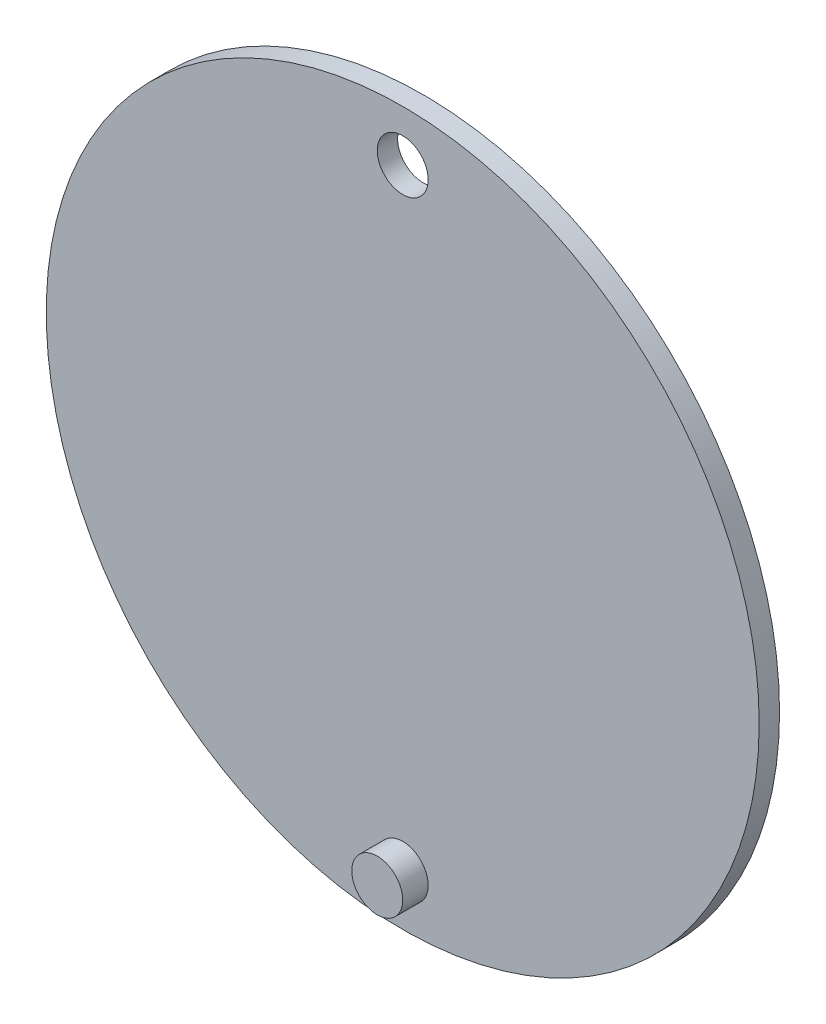
from build123d import *

# Parameters (mm, degrees)
SKETCH1_R           = 88.9
SKETCH1_R_2         = 6
SKETCH1_R_3         = 6.35
BOSS_EXTRUDE1_DEPTH = 5.08
SKETCH2_R           = 6.35
BOSS_EXTRUDE2_DEPTH = 11.43
SKETCH3_R           = 6.35
BOSS_EXTRUDE3_DEPTH = 50.8
CUT_EXTRUDE1_DEPTH  = 18


with BuildPart() as part:
    # Sketch1 → Boss-Extrude1 (new body)
    with BuildSketch(Plane.XY):
        Circle(SKETCH1_R)
        Circle(SKETCH1_R_2, mode=Mode.SUBTRACT)
        with Locations((0, -76.2)):
            Circle(SKETCH1_R_3, mode=Mode.SUBTRACT)
        with Locations((0, 76.2)):
            Circle(SKETCH1_R_3, mode=Mode.SUBTRACT)
    extrude(amount=BOSS_EXTRUDE1_DEPTH)

    # Sketch2 → Boss-Extrude2 (add)
    with BuildSketch(Plane.XY):
        with Locations((0, -76.2)):
            Circle(SKETCH2_R)
    extrude(amount=BOSS_EXTRUDE2_DEPTH)

    # Sketch3 → Boss-Extrude3 (add)
    with BuildSketch(Plane.XY.offset(5.08)):
        Circle(SKETCH3_R)
    extrude(amount=-BOSS_EXTRUDE3_DEPTH)

    # Sketch4 → Cut-Extrude1 (cut)
    with BuildSketch(Plane(origin=(0, 0, -45.72), x_dir=(-1, 0, 0), z_dir=(0, 0, -1))):
        with BuildLine():
            Line((3.05, 2.664582519), (3.05, -2.664582519))
            ThreePointArc((3.05, -2.664582519), (-4.05, 0), (3.05, 2.664582519))
        make_face()
    extrude(amount=-CUT_EXTRUDE1_DEPTH, mode=Mode.SUBTRACT)


solid = part.part
